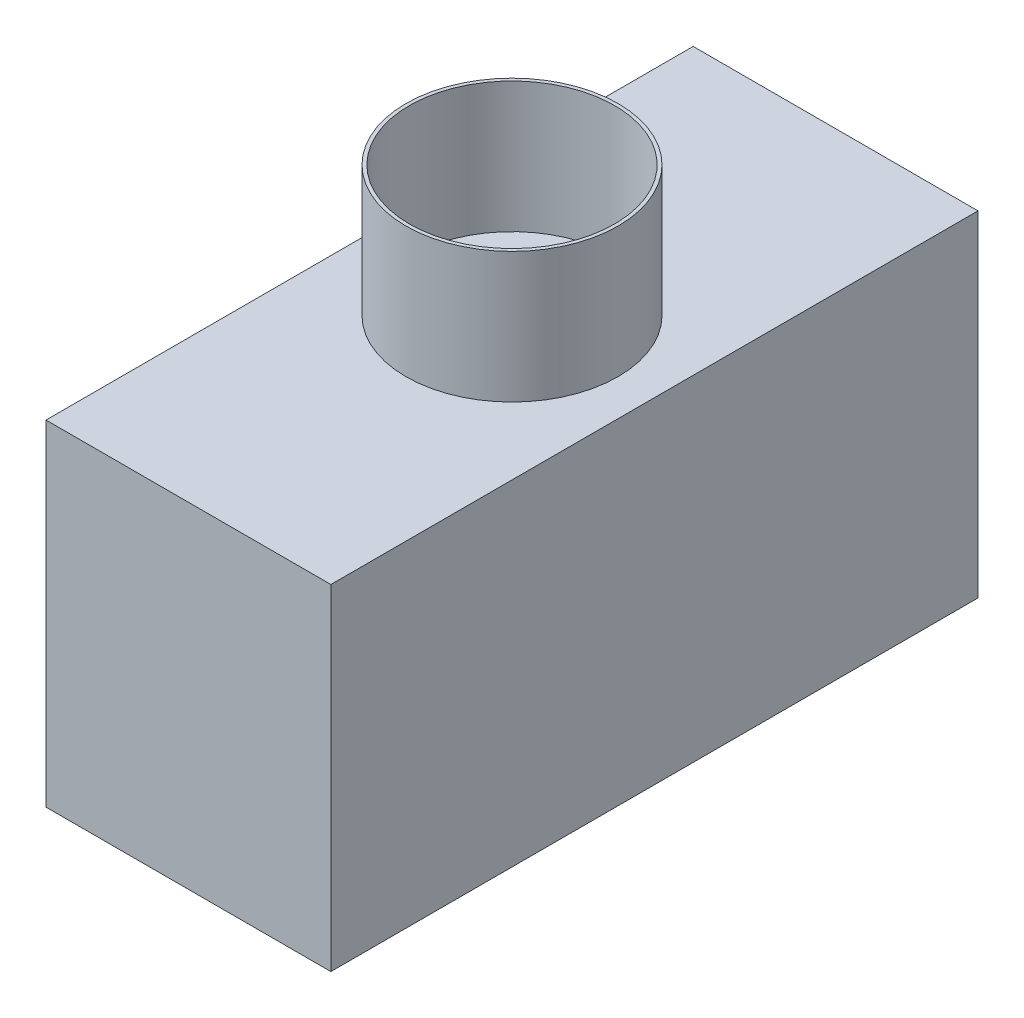
from build123d import *

# Parameters (mm, degrees)
SKETCH1_W               = 136.398
SKETCH1_H               = 309.88
EXTRUDE2_DEPTH          = 160.528
SKETCH3_R               = 50.8
EXTRUDE3_DEPTH          = 62.484
CUT_EXTRUDE1_DEPTH      = 19.05
CUT_EXTRUDE1_DEPTH_BACK = 62.484
SKETCH5_R               = 49.149


with BuildPart() as part:
    # Sketch1 → Extrude2 (new body)
    with BuildSketch(Plane(origin=(0, 0, 0), x_dir=(1, 0, 0), z_dir=(0, 1, 0))):
        with Locations((68.199, 154.94)):
            Rectangle(SKETCH1_W, SKETCH1_H)
    extrude(amount=EXTRUDE2_DEPTH)

    # Sketch3 → Extrude3 (add)
    with BuildSketch(Plane(origin=(0, 160.528, 0), x_dir=(-1, 0, 0), z_dir=(0, 1, 0))):
        with Locations(Location((-68.199, -154.94, 0), (0, 0, 270))):
            Circle(SKETCH3_R)
    extrude(amount=EXTRUDE3_DEPTH)

    # Sketch5 → Cut-Extrude1 (cut, two sides: drawn at the far end of the back side and taken through both)
    with BuildSketch(Plane(origin=(0, 223.012, 0), x_dir=(-1, 0, 0), z_dir=(0, 1, 0)).offset(-CUT_EXTRUDE1_DEPTH_BACK)):
        with Locations(Location((-68.199, -154.94, 0), (0, 0, 90))):
            Circle(SKETCH5_R)
    extrude(amount=CUT_EXTRUDE1_DEPTH + CUT_EXTRUDE1_DEPTH_BACK, mode=Mode.SUBTRACT)


solid = part.part
